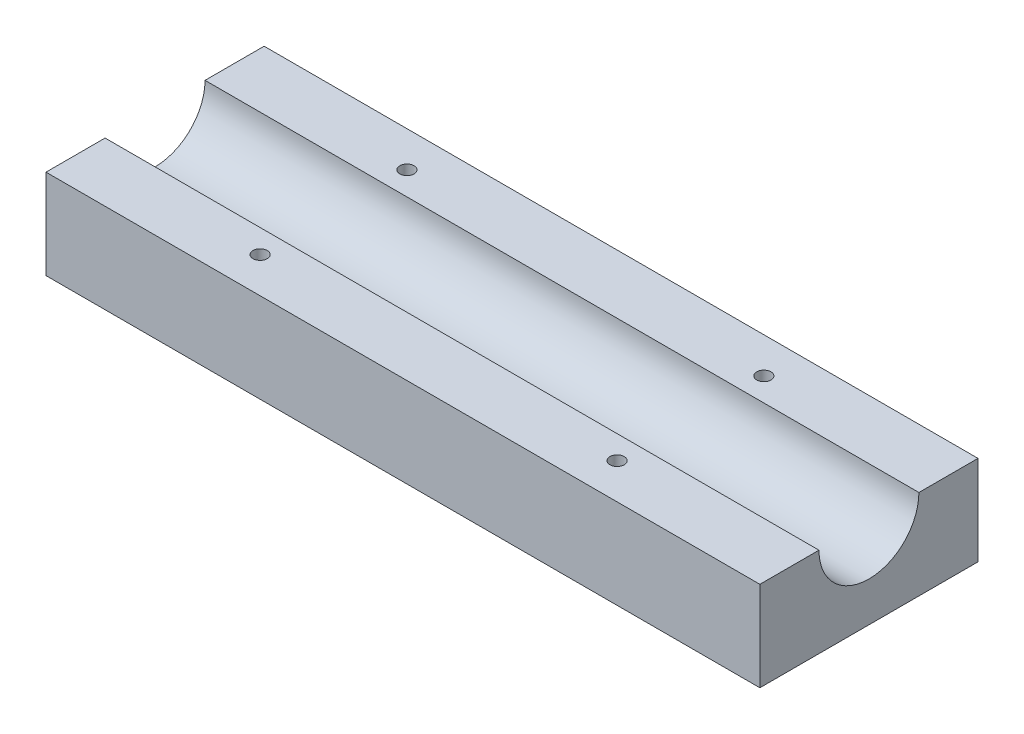
from build123d import *

# Parameters (mm, degrees)
SKETCH1_W           = 228.6
SKETCH1_H           = 69.85
BOSS_EXTRUDE1_DEPTH = 28.702
SKETCH2_R           = 16.002
CUT_EXTRUDE1_DEPTH  = 234.843934843
SKETCH3_R           = 2.286
CUT_EXTRUDE2_DEPTH  = 133.225641813
CUT_EXTRUDE3_DEPTH  = 2.54


with BuildPart() as part:
    # Sketch1 → Boss-Extrude1 (new body)
    with BuildSketch(Plane(origin=(0, 0, 0), x_dir=(1, 0, 0), z_dir=(0, 1, 0))):
        with Locations((8.413464991, -5.090260323)):
            Rectangle(SKETCH1_W, SKETCH1_H)
    extrude(amount=BOSS_EXTRUDE1_DEPTH)

    # Sketch2 → Cut-Extrude1 (cut, through all)
    with BuildSketch(Plane(origin=(122.713464991, 0, 0), x_dir=(0, 0, -1), z_dir=(1, 0, 0))):
        with Locations((-5.090260323, 28.702)):
            Circle(SKETCH2_R)
    extrude(amount=-CUT_EXTRUDE1_DEPTH, mode=Mode.SUBTRACT)

    # Sketch3 → Cut-Extrude2 (cut, through all)
    with BuildSketch(Plane(origin=(0, 28.702, 0), x_dir=(1, 0, 0), z_dir=(0, 1, 0))):
        with Locations(Location((-48.736535009, 18.415261035, 0), (0, 0, 270))):
            Circle(SKETCH3_R)
        with Locations(Location((-48.736535009, -28.595781682, 0), (0, 0, 90))):
            Circle(SKETCH3_R)
        with Locations(Location((65.563464991, 18.415261035, 0), (0, 0, 90))):
            Circle(SKETCH3_R)
        with Locations(Location((65.563464991, -28.595781682, 0), (0, 0, 270))):
            Circle(SKETCH3_R)
    extrude(amount=-CUT_EXTRUDE2_DEPTH, mode=Mode.SUBTRACT)

    # Sketch4 → Cut-Extrude3 (cut)
    with BuildSketch(Plane.XZ):
        Polygon((-49.788475899, 31.090068722), (-47.684271002, 31.090068722), (-46.19637345, 29.602171171), (-46.19637345, 27.497966274), (-47.684271002, 26.010068722), (-49.788475899, 26.010068722), (-51.27637345, 27.497966274), (-51.27637345, 29.602171171), align=None)
        Polygon((-46.19637345, -19.421650524), (-47.684271002, -20.909548076), (-49.788475899, -20.909548076), (-51.27637345, -19.421650524), (-51.27637345, -17.317445628), (-49.788475899, -15.829548076), (-47.684271002, -15.829548076), (-46.19637345, -17.317445628), align=None)
        Polygon((66.615405881, -20.909548076), (64.511200984, -20.909548076), (63.023303432, -19.421650524), (63.023303432, -17.317445628), (64.511200984, -15.829548076), (66.615405881, -15.829548076), (68.103303432, -17.317445628), (68.103303432, -19.421650524), align=None)
        Polygon((63.023303432, 29.602171171), (64.511200984, 31.090068722), (66.615405881, 31.090068722), (68.103303432, 29.602171171), (68.103303432, 27.497966274), (66.615405881, 26.010068722), (64.511200984, 26.010068722), (63.023303432, 27.497966274), align=None)
    extrude(amount=-CUT_EXTRUDE3_DEPTH, mode=Mode.SUBTRACT)


solid = part.part
